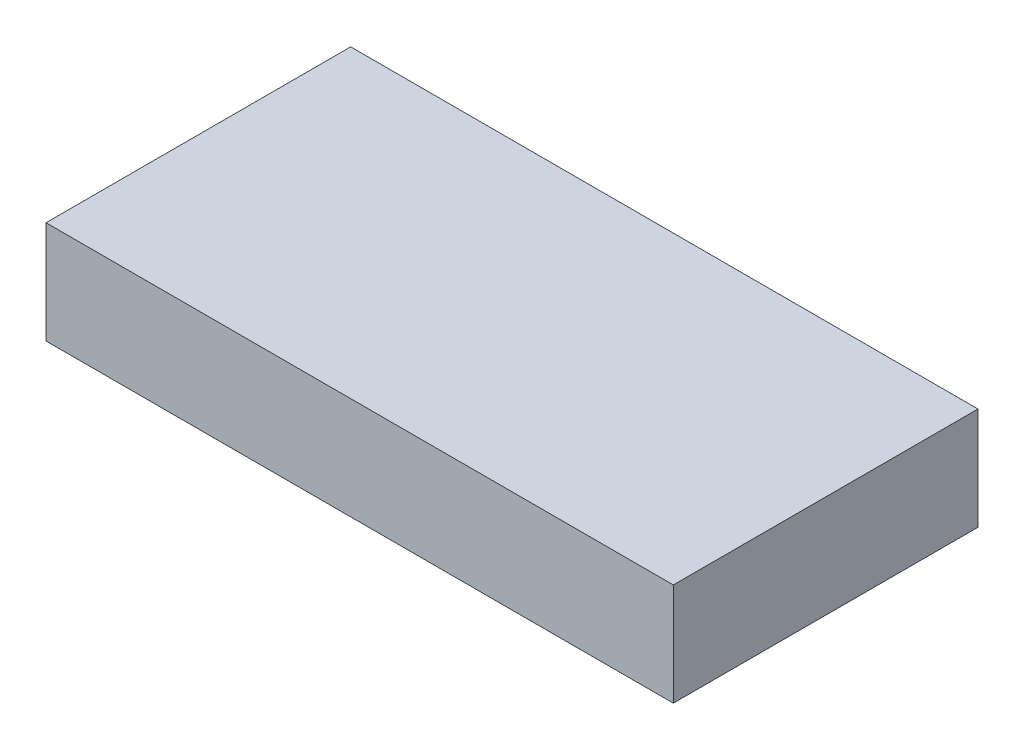
from build123d import *

# Parameters (mm, degrees)
SKETCH1_W           = 245
SKETCH1_H           = 119
BOSS_EXTRUDE1_DEPTH = 40


with BuildPart() as part:
    # Sketch1 → Boss-Extrude1 (new body)
    with BuildSketch(Plane(origin=(0, 0, 0), x_dir=(1, 0, 0), z_dir=(0, 1, 0))):
        with Locations((122.5, 59.5)):
            Rectangle(SKETCH1_W, SKETCH1_H)
    extrude(amount=BOSS_EXTRUDE1_DEPTH)


solid = part.part
